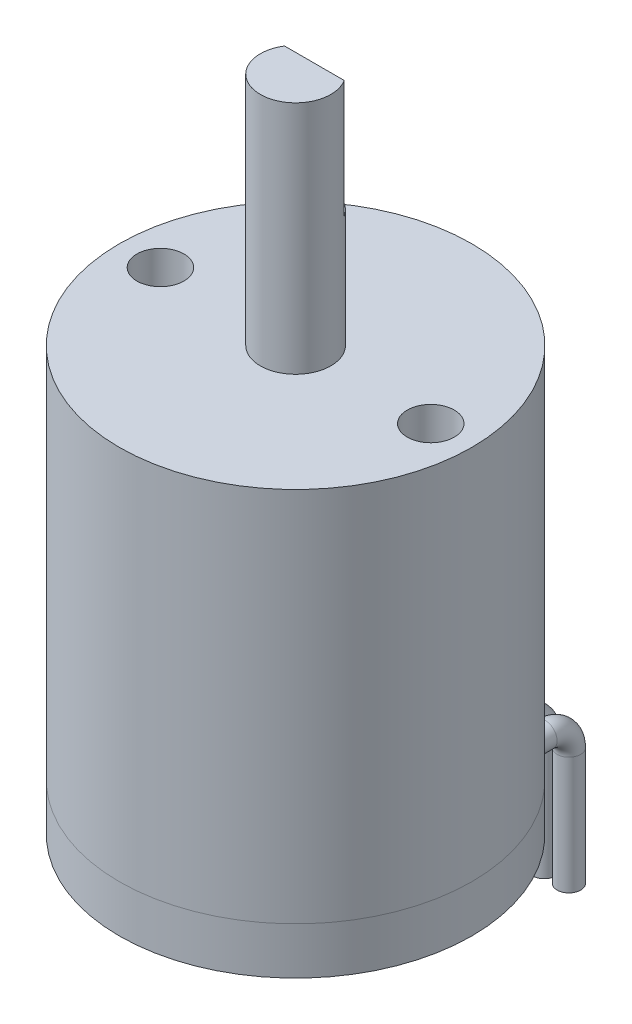
from build123d import *

# Parameters (mm, degrees)
SKETCH_2_R          = 1
CUT_EXTRUDE_1_DEPTH = 5
SKETCH_3_W          = 5.028706432
SKETCH_3_H          = 4.384892805
CUT_EXTRUDE_2_DEPTH = 5
SKETCH_5_R          = 0.5


with BuildPart() as part:
    # 草图1 → 旋转1 (revolve)
    with BuildSketch(Plane.XY, mode=Mode.PRIVATE) as revolve_1_sk:
        Polygon((0, 0), (0, 28), (1.5, 28), (1.5, 18), (7.5, 18), (7.5, 0), align=None)
    revolve(revolve_1_sk.sketch.rotate(Axis((0, 0, 0), (0, 1, 0)), 90), axis=Axis((0, 0, 0), (0, 1, 0)))

    # 草图2 → 切除-拉伸1 (cut)
    with BuildSketch(Plane(origin=(0, 18, 0), x_dir=(1, 0, 0), z_dir=(0, 1, 0))):
        with Locations(Location((-5.75, 0, 0), (0, 0, 270))):
            Circle(SKETCH_2_R)
        with Locations(Location((5.75, 0, 0), (0, 0, 90))):
            Circle(SKETCH_2_R)
    extrude(amount=-CUT_EXTRUDE_1_DEPTH, mode=Mode.SUBTRACT)

    # 草图3 → 切除-拉伸2 (cut)
    with BuildSketch(Plane(origin=(0, 28, 0), x_dir=(1, 0, 0), z_dir=(0, 1, 0))):
        with Locations((0, 2.992446403)):
            Rectangle(SKETCH_3_W, SKETCH_3_H)
    extrude(amount=-CUT_EXTRUDE_2_DEPTH, mode=Mode.SUBTRACT)

    # 扫描2: sweep along a path in 草图6
    with BuildLine(Plane(origin=(0, 0, 0), x_dir=(0, 0, -1), z_dir=(1, 0, 0))) as sweep_2_path:
        Line((0, 1), (8, 1))
        ThreePointArc((8, 1), (8.707106781, 0.707106781), (9, 0))
        Line((9, 0), (9, -5))
    # 草图5 → 扫描2 (sweep)
    with BuildSketch(Plane.XY):
        with Locations((0.525, 1)):
            Circle(SKETCH_5_R)
        with Locations((1.575, 1)):
            Circle(SKETCH_5_R)
        with Locations((2.625, 1)):
            Circle(SKETCH_5_R)
        with Locations((-2.625, 1)):
            Circle(SKETCH_5_R)
        with Locations((-1.575, 1)):
            Circle(SKETCH_5_R)
        with Locations((-0.525, 1)):
            Circle(SKETCH_5_R)
    sweep(path=sweep_2_path.line)


solid = part.part
